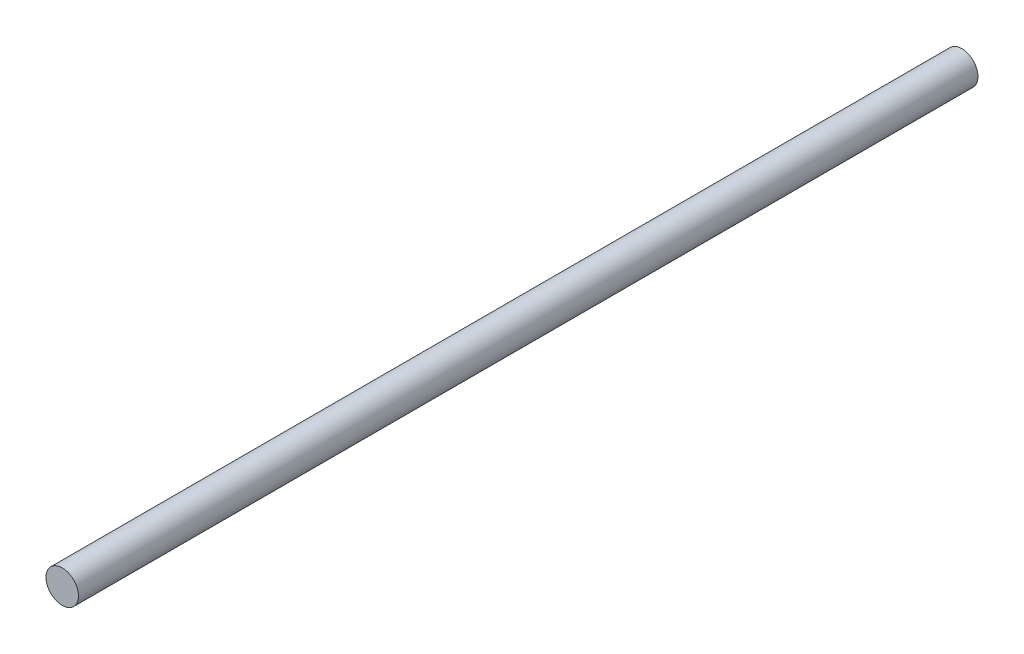
from build123d import *

# Parameters (mm, degrees)
SKETCH1_R           = 1.5
BOSS_EXTRUDE1_DEPTH = 83


with BuildPart() as part:
    # Sketch1 → Boss-Extrude1 (new body)
    with BuildSketch(Plane(origin=(0, 0, 0), x_dir=(0, 1, 0), z_dir=(0, 0, 1))):
        with Locations(Location((0, 0, 0), (0, 0, 270))):
            Circle(SKETCH1_R)
    extrude(amount=BOSS_EXTRUDE1_DEPTH)


solid = part.part
